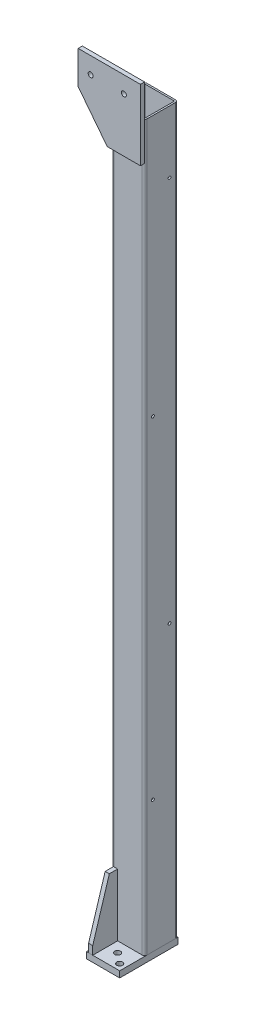
from build123d import *

# Parameters (mm, degrees)
MEMBER_1_DEPTH                   = 1745
SKETCH_4_W                       = 80
SKETCH_4_H                       = 140
EXTRUDE_1_DEPTH                  = 15
HOLE_WIZARD_14_0_14_1_AT_2_COUNT = 2
HOLE_WIZARD_14_0_14_1_AT_2_PITCH = 32.015621187
EXTRUDE_START                    = -60
EXTRUDE_2_DEPTH                  = 10
EXTRUDE_3_DEPTH                  = 10
HOLE_WIZARD_M10_1_AT_2_COUNT     = 2
HOLE_WIZARD_M10_1_AT_2_PITCH     = 80
HOLE_WIZARD_M8_1_AT_2_COUNT      = 2
HOLE_WIZARD_M8_1_AT_2_PITCH      = 930
HOLE_WIZARD_M8_3_AT_2_COUNT      = 2
HOLE_WIZARD_M8_3_AT_2_PITCH      = 800


with BuildPart() as part:
    # Sketch11 → Member 1 (new body)
    with BuildSketch(Plane(origin=(0, 1745, 0), x_dir=(0, 0, 1), z_dir=(0, -1, 0))):
        with BuildLine():
            Line((-34, -40), (34, -40))
            ThreePointArc((34, -40), (38.242640687, -38.242640687), (40, -34))
            Line((40, -34), (40, 34))
            ThreePointArc((40, 34), (38.242640687, 38.242640687), (34, 40))
            Line((34, 40), (-34, 40))
            ThreePointArc((-34, 40), (-38.242640687, 38.242640687), (-40, 34))
            Line((-40, 34), (-40, -34))
            ThreePointArc((-40, -34), (-38.242640687, -38.242640687), (-34, -40))
        make_face()
        with BuildLine():
            Line((-34, -36), (34, -36))
            ThreePointArc((34, -36), (35.414213562, -35.414213562), (36, -34))
            Line((36, -34), (36, 34))
            ThreePointArc((36, 34), (35.414213562, 35.414213562), (34, 36))
            Line((34, 36), (-34, 36))
            ThreePointArc((-34, 36), (-35.414213562, 35.414213562), (-36, 34))
            Line((-36, 34), (-36, -34))
            ThreePointArc((-36, -34), (-35.414213562, -35.414213562), (-34, -36))
        make_face(mode=Mode.SUBTRACT)
    extrude(amount=MEMBER_1_DEPTH)

    # 草图32 → M8 螺纹孔1 (revolve, cut)
    with BuildSketch(Plane(origin=(40, 1595, -20), x_dir=(0, 0, -1), z_dir=(0, 1, 0))):
        Polygon((0, 0), (0, 21.792926105), (3.4, 19.75), (3.4, 0), align=None)
    hole_wizard_m8_1 = revolve(axis=Axis((46.35, 1595, -20), (-1, 0, 0)), mode=Mode.SUBTRACT)

    # M8 螺纹孔1 at 2: M8 螺纹孔1 ×2
    with Locations(*[(0, -i * HOLE_WIZARD_M8_1_AT_2_PITCH, 0) for i in range(1, HOLE_WIZARD_M8_1_AT_2_COUNT)]):
        add(hole_wizard_m8_1, mode=Mode.SUBTRACT)

    # 草图38 → M8 螺纹孔3 (revolve, cut)
    with BuildSketch(Plane(origin=(40, 1117, 20.000000004), x_dir=(0, 0, -1), z_dir=(0, 1, 0))):
        Polygon((0, 0), (0, 24.292926105), (3.4, 22.25), (3.4, 0), align=None)
    hole_wizard_m8_3 = revolve(axis=Axis((46.35, 1117, 20.000000004), (-1, 0, 0)), mode=Mode.SUBTRACT)

    # M8 螺纹孔3 at 2: M8 螺纹孔3 ×2
    with Locations(*[(0, -i * HOLE_WIZARD_M8_3_AT_2_PITCH, 0) for i in range(1, HOLE_WIZARD_M8_3_AT_2_COUNT)]):
        add(hole_wizard_m8_3, mode=Mode.SUBTRACT)


with BuildPart() as body_2:
    # 草图4 → 凸台-拉伸1 (new body)
    with BuildSketch(Plane.XZ):
        with Locations((0, 30)):
            Rectangle(SKETCH_4_W, SKETCH_4_H)
    extrude(amount=EXTRUDE_1_DEPTH)

    # 草图12 → Ø14.0 (14) 直径孔1 (revolve, cut)
    with BuildSketch(Plane(origin=(25, 0, 85), x_dir=(0, 0, 1), z_dir=(1, 0, 0))):
        Polygon((0, 0), (0, 44.206024333), (7, 40), (7, 0), align=None)
    hole_wizard_14_0_14_1 = revolve(axis=Axis((25, 6.35, 85), (0, -1, 0)), mode=Mode.SUBTRACT)

    # Ø14.0 (14) 直径孔1 at 2: Ø14.0 (14) 直径孔1 ×2
    with Locations(*[Vector(-0.7808688094430303, 0, -0.6246950475544244) * (i * HOLE_WIZARD_14_0_14_1_AT_2_PITCH) for i in range(1, HOLE_WIZARD_14_0_14_1_AT_2_COUNT)]):
        add(hole_wizard_14_0_14_1, mode=Mode.SUBTRACT)


with BuildPart() as body_3:
    # 草图11 → 凸台-拉伸2 (new body)
    with BuildSketch(Plane(origin=(25, 0, 0), x_dir=(0, 0, -1), z_dir=(1, 0, 0)).offset(EXTRUDE_START)):
        Polygon((-100, 20), (-60, 150), (-40, 150), (-40, 0), (-100, 0), align=None)
    extrude(amount=EXTRUDE_2_DEPTH)


with BuildPart() as body_4:
    # 草图20 → 凸台-拉伸3 (new body)
    with BuildSketch(Plane.XY.offset(40)):
        Polygon((40, 1655), (40, 1825), (-110, 1825), (-110, 1745), (-40, 1655), align=None)
    extrude(amount=EXTRUDE_3_DEPTH)

    # 草图30 → M10 间隙孔1 (revolve, cut)
    with BuildSketch(Plane(origin=(0, 1785, 40), x_dir=(0, 1, 0), z_dir=(1, 0, 0))):
        Polygon((0, 0), (0, 33.605163714), (6, 30), (6, 0), align=None)
    hole_wizard_m10_1 = revolve(axis=Axis((0, 1785, 33.65), (0, 0, 1)), mode=Mode.SUBTRACT)

    # M10 间隙孔1 at 2: M10 间隙孔1 ×2
    with Locations(*[(-i * HOLE_WIZARD_M10_1_AT_2_PITCH, 0, 0) for i in range(1, HOLE_WIZARD_M10_1_AT_2_COUNT)]):
        add(hole_wizard_m10_1, mode=Mode.SUBTRACT)


solid = Compound([part.part, body_2.part, body_3.part, body_4.part])
